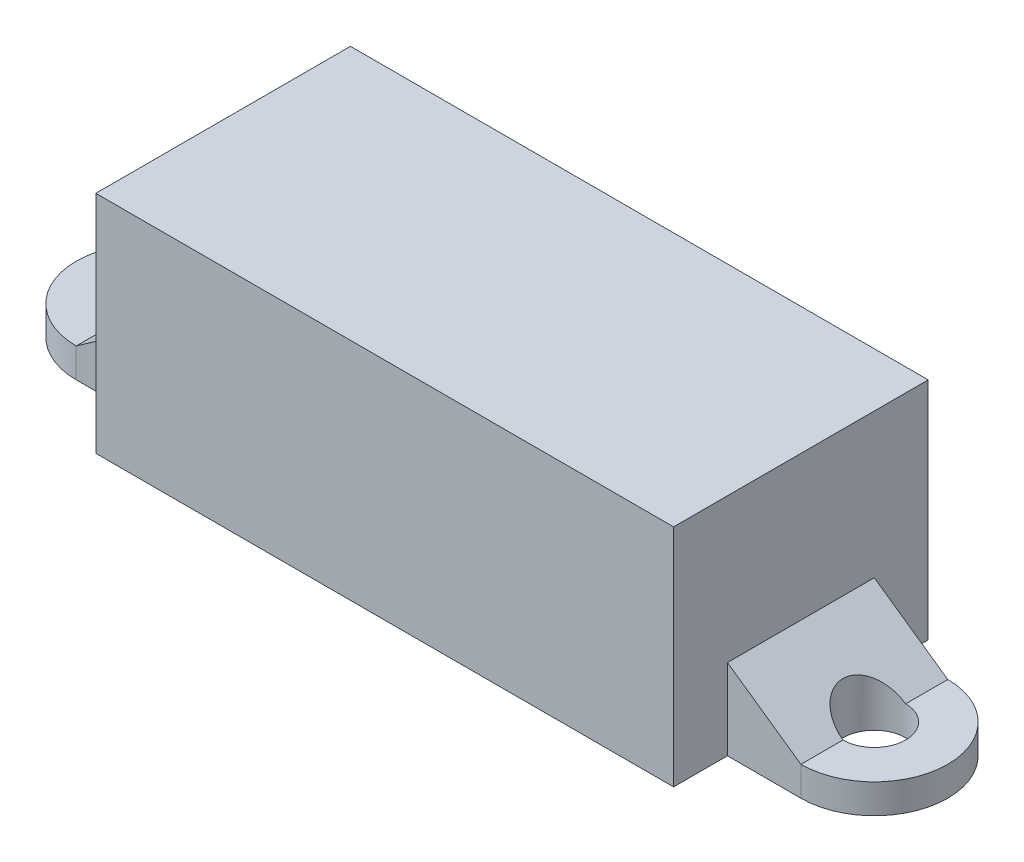
from build123d import *

# Parameters (mm, degrees)
CROQUIS1_R                 = 1.6
SALIENTE_EXTRUIR2_DEPTH    = 11.5
CORTAR_EXTRUIR1_DEPTH      = 26.875905781
CORTAR_EXTRUIR1_DEPTH_BACK = 26.875905781


with BuildPart() as part:
    # Croquis1 → Saliente-Extruir2 (new body)
    with BuildSketch(Plane(origin=(0, 0, 0), x_dir=(1, 0, 0), z_dir=(0, 1, 0))):
        with BuildLine():
            Line((-14.75, -6.5), (14.75, -6.5))
            Line((14.75, -6.5), (14.75, -3.75))
            Line((14.75, -3.75), (18.5, -3.75))
            ThreePointArc((18.5, -3.75), (22.25, 0), (18.5, 3.75))
            Line((18.5, 3.75), (14.75, 3.75))
            Line((14.75, 3.75), (14.75, 6.5))
            Line((14.75, 6.5), (-14.75, 6.5))
            Line((-14.75, 6.5), (-14.75, 3.75))
            Line((-14.75, 3.75), (-18.5, 3.75))
            ThreePointArc((-18.5, 3.75), (-22.25, 0), (-18.5, -3.75))
            Line((-18.5, -3.75), (-14.75, -3.75))
            Line((-14.75, -3.75), (-14.75, -6.5))
        make_face()
        with Locations(Location((-18.5, 0, 0), (0, 0, 270))):
            Circle(CROQUIS1_R, mode=Mode.SUBTRACT)
        with Locations(Location((18.5, 0, 0), (0, 0, 90))):
            Circle(CROQUIS1_R, mode=Mode.SUBTRACT)
    extrude(amount=SALIENTE_EXTRUIR2_DEPTH)

    # Croquis2 → Cortar-Extruir1 (cut, two sides: drawn at the far end of the back side and taken through both)
    with BuildSketch(Plane.XY.offset(-CORTAR_EXTRUIR1_DEPTH_BACK)):
        Polygon((22.25, 11.5), (22.25, 1.5), (18.5, 1.5), (14.75, 4.125778268), (14.75, 11.5), align=None)
        Polygon((-22.25, 11.5), (-22.25, 1.5), (-18.5, 1.5), (-14.75, 4.125778268), (-14.75, 11.5), align=None)
    extrude(amount=CORTAR_EXTRUIR1_DEPTH + CORTAR_EXTRUIR1_DEPTH_BACK, mode=Mode.SUBTRACT)


solid = part.part
